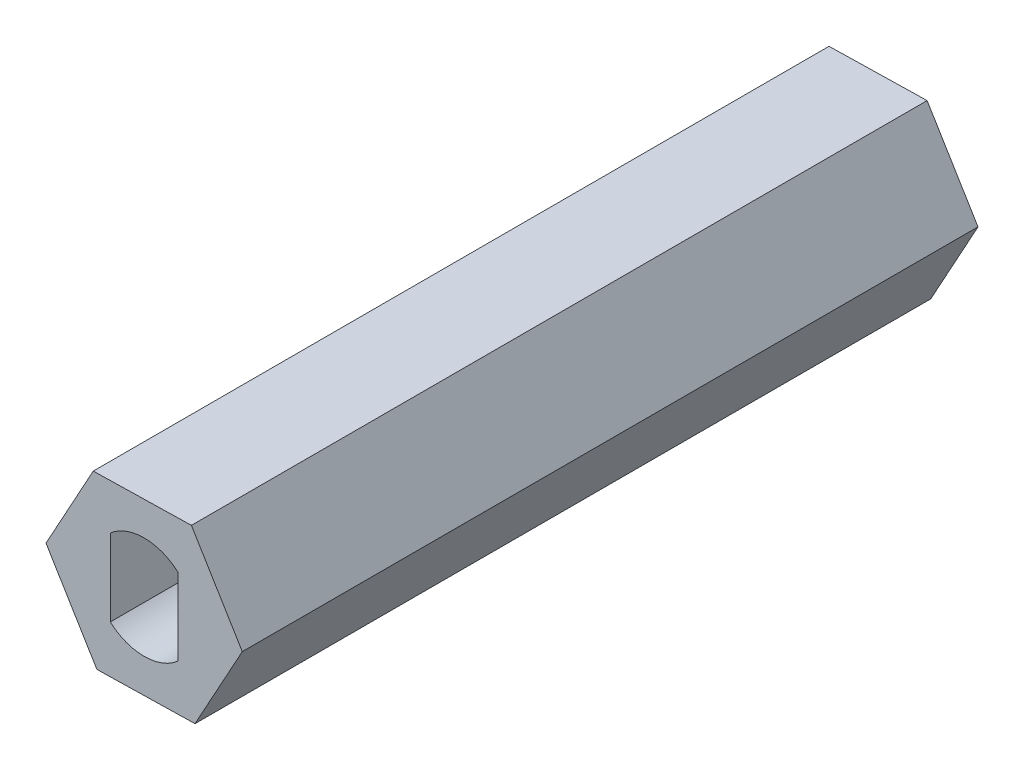
from build123d import *

# Parameters (mm, degrees)
BOSS_EXTRUDE1_DEPTH = 8
BOSS_EXTRUDE2_DEPTH = 30


with BuildPart() as part:
    # Sketch1 → Boss-Extrude1 (new body)
    with BuildSketch(Plane.XY):
        Polygon((2.441453407, 4.443445202), (-2.627409721, 4.336083274), (-5.068863129, -0.107361928), (-2.441453407, -4.443445202), (2.627409721, -4.336083274), (5.068863129, 0.107361928), align=None)
        with BuildLine():
            Line((1.75, 2.004770405), (1.75, -1.975229595))
            ThreePointArc((1.75, -1.975229595), (0, -2.638945235), (-1.75, -1.975229595))
            Line((-1.75, -1.975229595), (-1.75, 2.004770405))
            ThreePointArc((-1.75, 2.004770405), (0, 2.661128403), (1.75, 2.004770405))
        make_face(mode=Mode.SUBTRACT)
    extrude(amount=BOSS_EXTRUDE1_DEPTH)

    # Sketch2 → Boss-Extrude2 (add)
    with BuildSketch(Plane(origin=(0, 0, 0), x_dir=(-1, 0, 0), z_dir=(0, 0, -1))):
        Polygon((2.627409721, 4.336083274), (-2.441453407, 4.443445202), (-5.068863129, 0.107361928), (-2.627409721, -4.336083274), (2.441453407, -4.443445202), (5.068863129, -0.107361928), align=None)
    extrude(amount=BOSS_EXTRUDE2_DEPTH)


solid = part.part
